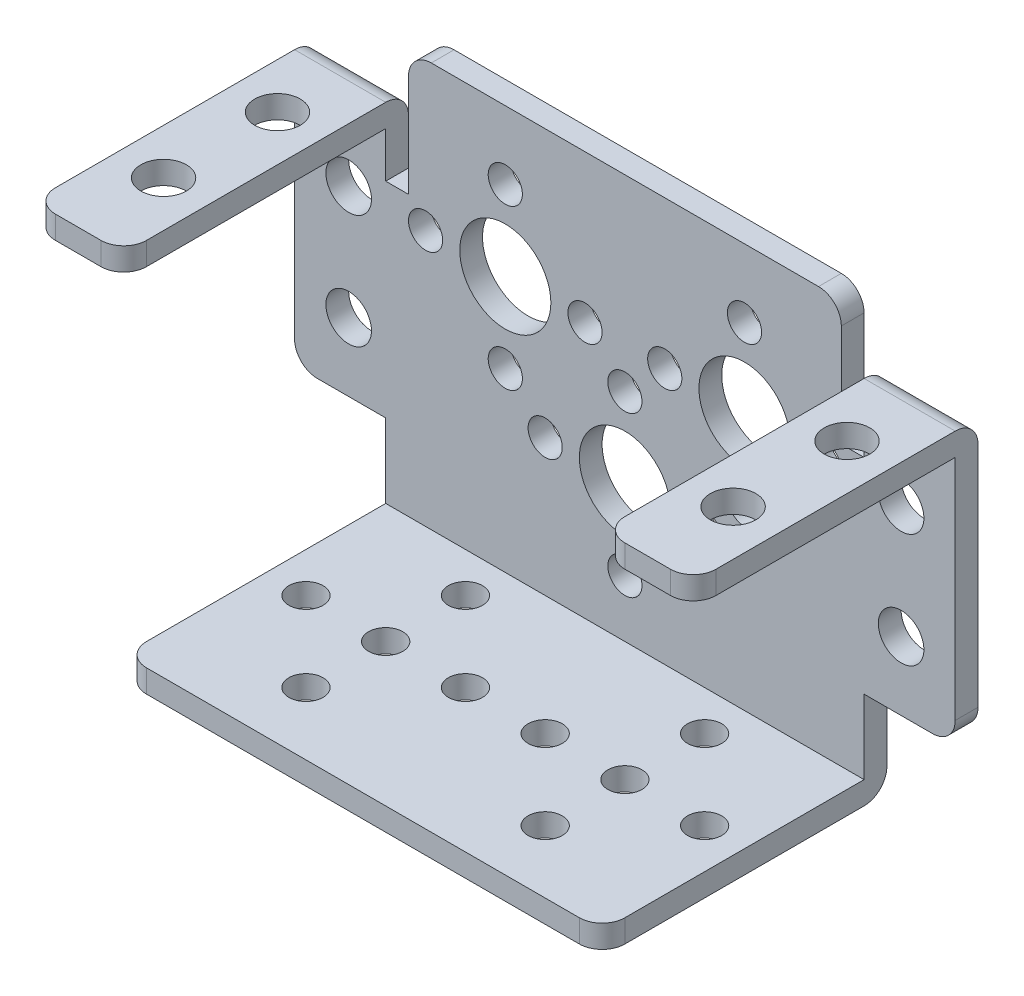
from build123d import *

# Parameters (mm, degrees)
CROQUIS1_R                 = 1.5
CROQUIS1_R_2               = 2
CROQUIS1_R_3               = 4
SALIENTE_EXTRUIR1_DEPTH    = 2
CROQUIS2_W                 = 42
CROQUIS2_H                 = 2
CROQUIS2_W_2               = 8
SALIENTE_EXTRUIR2_DEPTH    = 25
REDONDEO2_R                = 2
CORTAR_EXTRUIR1_DEPTH      = 25
CORTAR_EXTRUIR1_DEPTH_BACK = 25
CROQUIS3_R                 = 1.5
CROQUIS3_R_2               = 2


with BuildPart() as part:
    # Croquis1 → Saliente-Extruir1 (new body)
    with BuildSketch(Plane.XY):
        with BuildLine():
            Line((-21, -12), (21, -12))
            Line((21, -12), (21, -5.5))
            Line((21, -5.5), (27, -5.5))
            ThreePointArc((27, -5.5), (28.414213562, -4.914213562), (29, -3.5))
            Line((29, -3.5), (29, 16.5))
            Line((29, 16.5), (21, 16.5))
            Line((21, 16.5), (21, 12.5))
            Line((21, 12.5), (19, 12.5))
            Line((19, 12.5), (19, 21.49))
            ThreePointArc((19, 21.49), (18.414213562, 22.904213562), (17, 23.49))
            Line((17, 23.49), (-17, 23.49))
            ThreePointArc((-17, 23.49), (-18.414213562, 22.904213562), (-19, 21.49))
            Line((-19, 21.49), (-19, 12.5))
            Line((-19, 12.5), (-21, 12.5))
            Line((-21, 12.5), (-21, 16.5))
            Line((-21, 16.5), (-29, 16.5))
            Line((-29, 16.5), (-29, -3.5))
            ThreePointArc((-29, -3.5), (-28.414213562, -4.914213562), (-27, -5.5))
            Line((-27, -5.5), (-21, -5.5))
            Line((-21, -5.5), (-21, -12))
        make_face()
        with Locations((0, 7)):
            Circle(CROQUIS1_R, mode=Mode.SUBTRACT)
        with Locations((7, 0)):
            Circle(CROQUIS1_R, mode=Mode.SUBTRACT)
        with Locations((0, -7)):
            Circle(CROQUIS1_R, mode=Mode.SUBTRACT)
        with Locations((-7, 0)):
            Circle(CROQUIS1_R, mode=Mode.SUBTRACT)
        with Locations((-24.25, 10.5)):
            Circle(CROQUIS1_R_2, mode=Mode.SUBTRACT)
        with Locations((24.25, 10.5)):
            Circle(CROQUIS1_R_2, mode=Mode.SUBTRACT)
        with Locations((-24.25, 0.5)):
            Circle(CROQUIS1_R_2, mode=Mode.SUBTRACT)
        Circle(CROQUIS1_R_3, mode=Mode.SUBTRACT)
        with Locations((10.5, 17.5)):
            Circle(CROQUIS1_R, mode=Mode.SUBTRACT)
        with Locations((17.5, 10.5)):
            Circle(CROQUIS1_R, mode=Mode.SUBTRACT)
        with Locations((10.5, 3.5)):
            Circle(CROQUIS1_R, mode=Mode.SUBTRACT)
        with Locations((3.5, 10.5)):
            Circle(CROQUIS1_R, mode=Mode.SUBTRACT)
        with Locations((-10.5, 17.5)):
            Circle(CROQUIS1_R, mode=Mode.SUBTRACT)
        with Locations((-3.5, 10.5)):
            Circle(CROQUIS1_R, mode=Mode.SUBTRACT)
        with Locations((-10.5, 3.5)):
            Circle(CROQUIS1_R, mode=Mode.SUBTRACT)
        with Locations((-17.5, 10.5)):
            Circle(CROQUIS1_R, mode=Mode.SUBTRACT)
        with Locations((-10.5, 10.5)):
            Circle(CROQUIS1_R_3, mode=Mode.SUBTRACT)
        with Locations((10.5, 10.5)):
            Circle(CROQUIS1_R_3, mode=Mode.SUBTRACT)
        with Locations((24.25, 0.5)):
            Circle(CROQUIS1_R_2, mode=Mode.SUBTRACT)
    extrude(amount=SALIENTE_EXTRUIR1_DEPTH)

    # Croquis2 → Saliente-Extruir2 (add)
    with BuildSketch(Plane.XY):
        with Locations((0, -13)):
            Rectangle(CROQUIS2_W, CROQUIS2_H)
        with Locations((-25, 17.5)):
            Rectangle(CROQUIS2_W_2, CROQUIS2_H)
        with Locations((25, 17.5)):
            Rectangle(CROQUIS2_W_2, CROQUIS2_H)
    extrude(amount=SALIENTE_EXTRUIR2_DEPTH)

    # Redondeo2
    redondeo2_edges = [part.edges().sort_by_distance(p)[0] for p in [
        (0, -14, 0),
        (-21, -13, 25),
        (21, -13, 25),
        (-25, 18.5, 0),
        (-21, 17.5, 25),
        (-29, 17.5, 25),
        (25, 18.5, 0),
        (29, 17.5, 25),
        (21, 17.5, 25),
    ]]
    fillet(redondeo2_edges, radius=REDONDEO2_R)

    # Croquis3 → Cortar-Extruir1 (cut, two sides: drawn at the far end of the back side and taken through both)
    with BuildSketch(Plane(origin=(0, 0, 0), x_dir=(1, 0, 0), z_dir=(0, 1, 0)).offset(-CORTAR_EXTRUIR1_DEPTH_BACK)):
        with Locations(Location((-10.5, -12.5, 0), (0, 0, 90))):
            Circle(CROQUIS3_R)
        with Locations(Location((10.5, -12.5, 0), (0, 0, 90))):
            Circle(CROQUIS3_R)
        with Locations(Location((-10.5, -5.5, 0), (0, 0, 90))):
            Circle(CROQUIS3_R)
        with Locations(Location((-3.5, -12.5, 0), (0, 0, 90))):
            Circle(CROQUIS3_R)
        with Locations(Location((-10.5, -19.5, 0), (0, 0, 90))):
            Circle(CROQUIS3_R)
        with Locations(Location((-17.5, -12.5, 0), (0, 0, 90))):
            Circle(CROQUIS3_R)
        with Locations(Location((3.5, -12.5, 0), (0, 0, 90))):
            Circle(CROQUIS3_R)
        with Locations(Location((10.5, -19.5, 0), (0, 0, 90))):
            Circle(CROQUIS3_R)
        with Locations(Location((10.5, -5.5, 0), (0, 0, 90))):
            Circle(CROQUIS3_R)
        with Locations(Location((17.5, -12.5, 0), (0, 0, 90))):
            Circle(CROQUIS3_R)
        with Locations(Location((-25, -7.5, 0), (0, 0, 90))):
            Circle(CROQUIS3_R_2)
        with Locations(Location((-25, -17.5, 0), (0, 0, 90))):
            Circle(CROQUIS3_R_2)
        with Locations(Location((25, -17.5, 0), (0, 0, 90))):
            Circle(CROQUIS3_R_2)
        with Locations(Location((25, -7.5, 0), (0, 0, 90))):
            Circle(CROQUIS3_R_2)
    extrude(amount=CORTAR_EXTRUIR1_DEPTH + CORTAR_EXTRUIR1_DEPTH_BACK, mode=Mode.SUBTRACT)


solid = part.part
